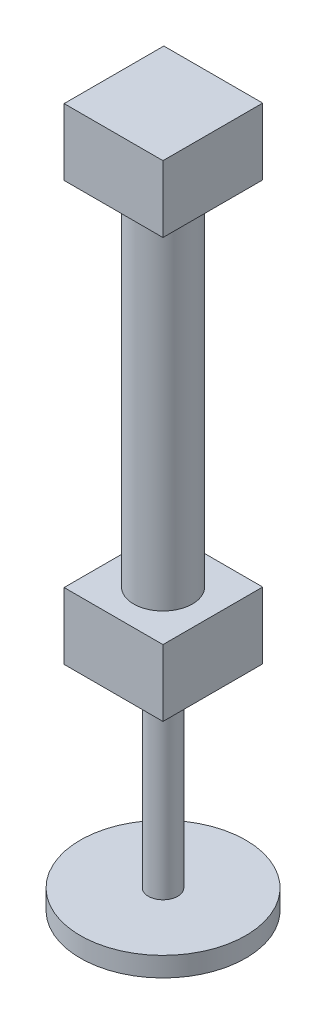
from build123d import *

# Parameters (mm, degrees)
SKETCH1_R           = 15
BOSS_EXTRUDE2_DEPTH = 194
SKETCH2_W           = 50.475671087
SKETCH2_H           = 50.915354634
BOSS_EXTRUDE3_DEPTH = 34
SKETCH3_R           = 7.5
BOSS_EXTRUDE4_DEPTH = 99
SKETCH5_R           = 42.253100096
BOSS_EXTRUDE5_DEPTH = 10


with BuildPart() as part:
    # Sketch1 → Boss-Extrude2 (new body)
    with BuildSketch(Plane(origin=(0, 0, 0), x_dir=(1, 0, 0), z_dir=(0, 1, 0))):
        with Locations(Location((0, 0, 0), (0, 0, 270))):
            Circle(SKETCH1_R)
    extrude(amount=BOSS_EXTRUDE2_DEPTH)

    # Sketch2 → Boss-Extrude3 (add)
    with BuildSketch(Plane.XZ):
        with Locations((0.175873419, 0)):
            Rectangle(SKETCH2_W, SKETCH2_H)
    boss_extrude3 = extrude(amount=BOSS_EXTRUDE3_DEPTH)

    # Mirror1: Boss-Extrude3 across plane
    add(boss_extrude3.mirror(Plane.ZX.offset(90)))

    # Sketch3 → Boss-Extrude4 (add)
    with BuildSketch(Plane.XZ.offset(34)):
        with Locations(Location((0, 0, 0), (0, 0, 90))):
            Circle(SKETCH3_R)
    extrude(amount=BOSS_EXTRUDE4_DEPTH)

    # Sketch5 → Boss-Extrude5 (add)
    with BuildSketch(Plane.XZ.offset(133)):
        with Locations(Location((0, 0, 0), (0, 0, 270))):
            Circle(SKETCH5_R)
    extrude(amount=BOSS_EXTRUDE5_DEPTH)


solid = part.part
